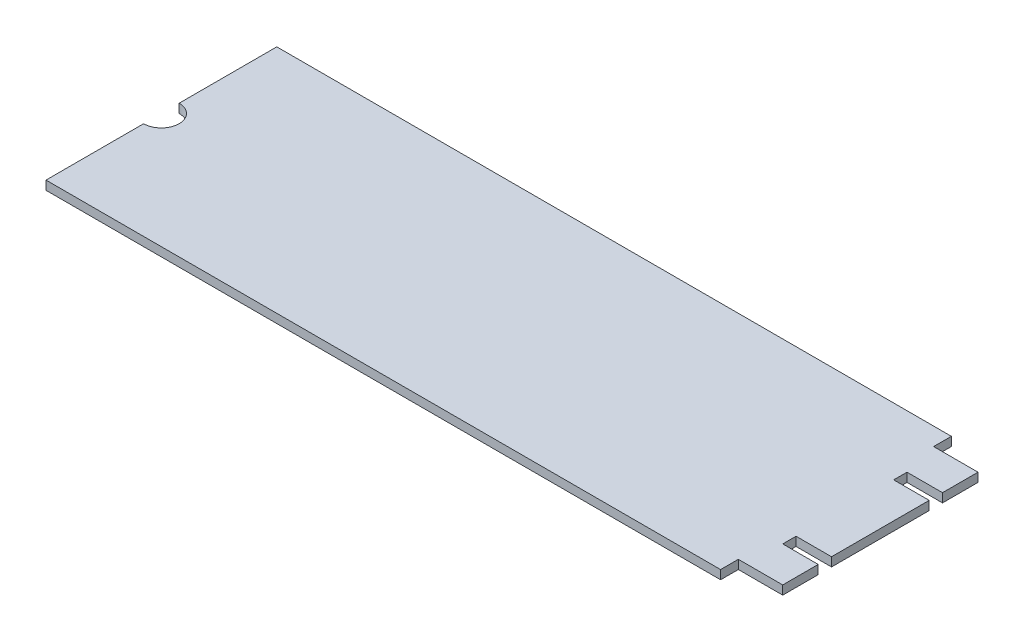
from build123d import *

# Parameters (mm, degrees)
EXTRUDE_1_DEPTH = 1


with BuildPart() as part:
    # 草圖1 → 填料-伸長1 (new body)
    with BuildSketch(Plane(origin=(0, 0, 0), x_dir=(1, 0, 0), z_dir=(0, 1, 0))):
        with BuildLine():
            Line((0, 0), (76, 0))
            Line((76, 0), (76, 2))
            Line((76, 2), (81, 2))
            Line((81, 2), (81, 6))
            Line((81, 6), (77, 6))
            Line((77, 6), (77, 7.5))
            Line((77, 7.5), (81, 7.5))
            Line((81, 7.5), (81, 18.5))
            Line((81, 18.5), (77, 18.5))
            Line((77, 18.5), (77, 20))
            Line((77, 20), (81, 20))
            Line((81, 20), (81, 24))
            Line((81, 24), (76, 24))
            Line((76, 24), (76, 26))
            Line((76, 26), (0, 26))
            Line((0, 26), (0, 15))
            ThreePointArc((0, 15), (2, 13), (0, 11))
            Line((0, 11), (0, 0))
        make_face()
    extrude(amount=EXTRUDE_1_DEPTH)


solid = part.part
